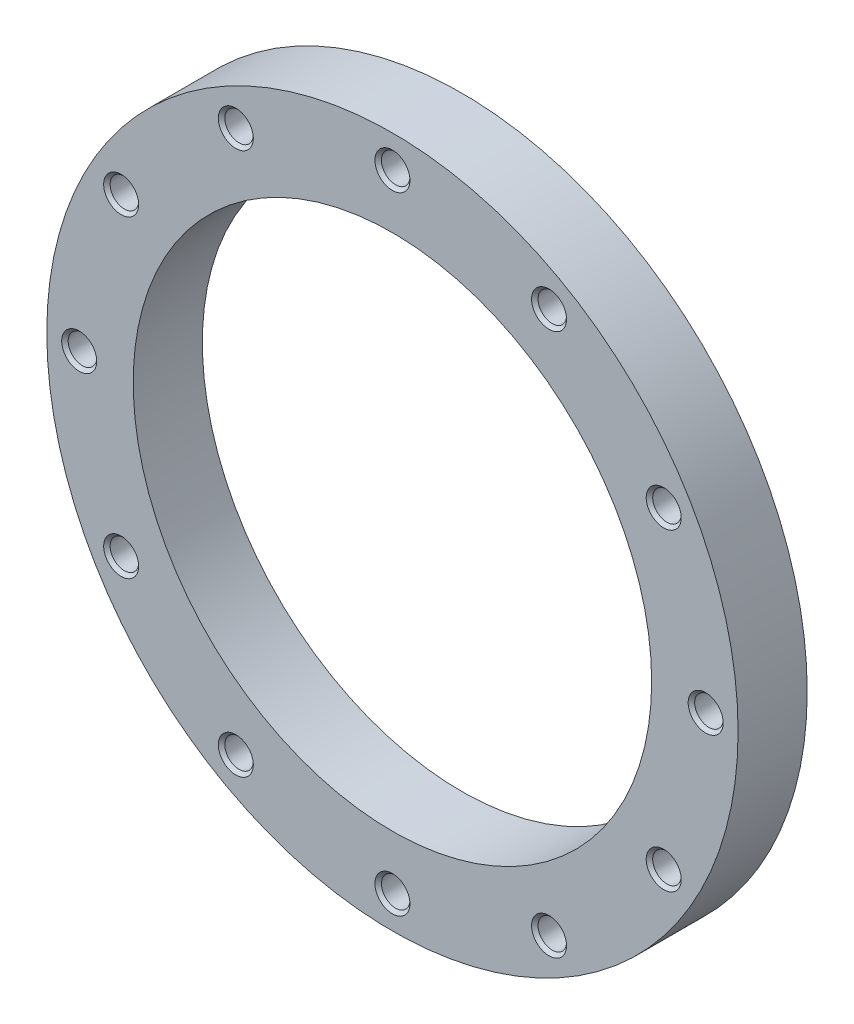
from build123d import *

# Parameters (mm, degrees)
SKETCH1_R                       = 40
SKETCH1_R_2                     = 30
BOSS_EXTRUDE1_DEPTH             = 8
M4X0_7_TAPPED_HOLE1_D           = 3.3
M4X0_7_TAPPED_HOLE1_CSINK_D     = 4.05
M4X0_7_TAPPED_HOLE1_CSINK_ANGLE = 90
CIRPATTERN1_COUNT               = 12


with BuildPart() as part:
    # Sketch1 → Boss-Extrude1 (new body)
    with BuildSketch(Plane.XY):
        Circle(SKETCH1_R)
        Circle(SKETCH1_R_2, mode=Mode.SUBTRACT)
    extrude(amount=-BOSS_EXTRUDE1_DEPTH)

    # M4x0.7 Tapped Hole1 (through all)
    with Locations(Plane.XY):
        with Locations((0, 36.25)):
            m4x0_7_tapped_hole1 = CounterSinkHole(M4X0_7_TAPPED_HOLE1_D / 2, M4X0_7_TAPPED_HOLE1_CSINK_D / 2, counter_sink_angle=M4X0_7_TAPPED_HOLE1_CSINK_ANGLE)

    # CirPattern1: M4x0.7 Tapped Hole1 ×12 about axis
    cirpattern1_axis = Axis((0, 0, 0), (0, 0, 1))
    for i in range(1, CIRPATTERN1_COUNT):
        add(m4x0_7_tapped_hole1.rotate(cirpattern1_axis, i * 360 / CIRPATTERN1_COUNT), mode=Mode.SUBTRACT)


solid = part.part
